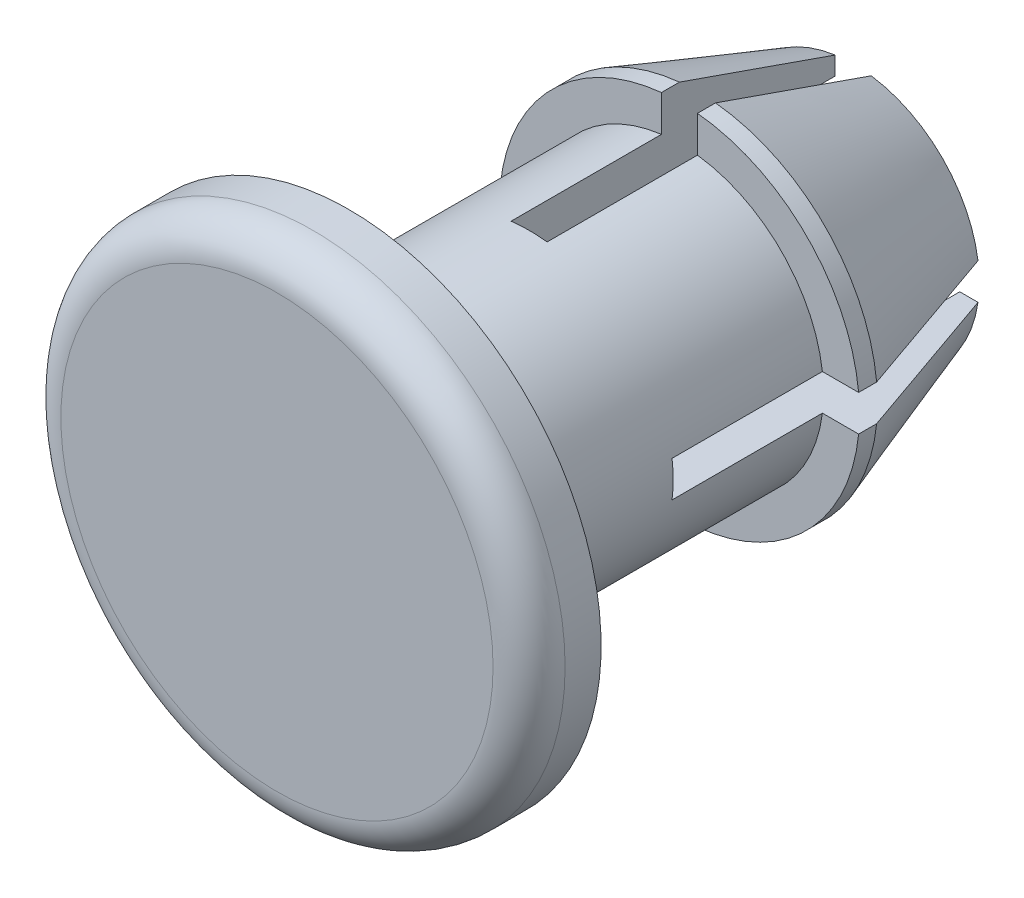
from build123d import *

# Parameters (mm, degrees)
SKETCH1_R           = 7
BOSS_EXTRUDE1_DEPTH = 8
SKETCH2_OUTSIDE_W   = 21.092
SKETCH2_OUTSIDE_H   = 21.092
SKETCH2_OUTSIDE_R   = 5
CUT_EXTRUDE1_DEPTH  = 14
SKETCH3_W           = 9
SKETCH3_H           = 9.175
SKETCH4_R           = 3
CUT_EXTRUDE2_DEPTH  = 15
CUT_EXTRUDE3_DEPTH  = 9
FILLET1_R           = 1


with BuildPart() as part:
    # Sketch1 → Boss-Extrude1 (new, symmetric)
    with BuildSketch(Plane.XY):
        Circle(SKETCH1_R)
    extrude(amount=BOSS_EXTRUDE1_DEPTH, both=True)

    # Sketch2 outside → Cut-Extrude1 (cut)
    with BuildSketch(Plane(origin=(0, 0, -8), x_dir=(-1, 0, 0), z_dir=(0, 0, -1))):
        Rectangle(SKETCH2_OUTSIDE_W, SKETCH2_OUTSIDE_H)
        Circle(SKETCH2_OUTSIDE_R, mode=Mode.SUBTRACT)
    extrude(amount=-CUT_EXTRUDE1_DEPTH, mode=Mode.SUBTRACT)

    # Sketch3 → Cut-Revolve1 (revolve, cut)
    with BuildSketch(Plane(origin=(0, 0, 0), x_dir=(1, 0, 0), z_dir=(0, 1, 0)), mode=Mode.PRIVATE) as cut_revolve1_sk:
        Polygon((-5, 3.675), (-3.5, 8), (-5, 8), align=None)
        with Locations((-8.5, -1.4125)):
            Rectangle(SKETCH3_W, SKETCH3_H)
    revolve(cut_revolve1_sk.sketch.rotate(Axis((0, 0, 6), (0, 0, -1)), 180), axis=Axis((0, 0, 6), (0, 0, -1)), mode=Mode.SUBTRACT)

    # Sketch4 → Cut-Extrude2 (cut)
    with BuildSketch(Plane(origin=(0, 0, -8), x_dir=(-1, 0, 0), z_dir=(0, 0, -1))):
        Circle(SKETCH4_R)
    extrude(amount=-CUT_EXTRUDE2_DEPTH, mode=Mode.SUBTRACT)

    # Sketch5 → Cut-Extrude3 (cut)
    with BuildSketch(Plane(origin=(0, 0, -8), x_dir=(-1, 0, 0), z_dir=(0, 0, -1))):
        Polygon((-0.5, 12), (0.5, 12), (0.5, 0.5), (12, 0.5), (12, -0.5), (0.5, -0.5), (0.5, -12), (-0.5, -12), (-0.5, -0.5), (-12, -0.5), (-12, 0.5), (-0.5, 0.5), align=None)
    extrude(amount=-CUT_EXTRUDE3_DEPTH, mode=Mode.SUBTRACT)

    # Fillet1
    fillet1_edges = [part.edges().sort_by_distance(p)[0] for p in [
        (-7, 0, 8),
    ]]
    fillet(fillet1_edges, radius=FILLET1_R)


solid = part.part
